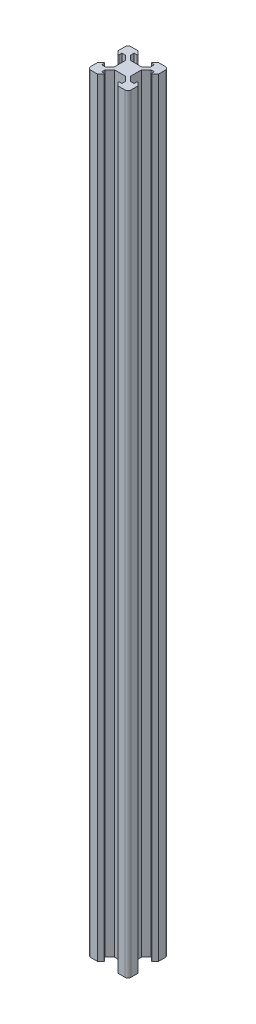
from build123d import *

# Parameters (mm, degrees)
EXTRUDE_1_DEPTH = 380


with BuildPart() as part:
    # Эскиз1 → Бобышка-Вытянуть1 (new body)
    with BuildSketch(Plane(origin=(0, 0, 0), x_dir=(1, 0, 0), z_dir=(0, 1, 0))):
        with BuildLine():
            Line((6.272792206, 5), (8, 5))
            Line((8, 5), (8, 3.724264069))
            ThreePointArc((8, 3.724264069), (8.18519497, 3.447100209), (8.512132034, 3.512132034))
            Line((8.512132034, 3.512132034), (10, 5))
            Line((10, 5), (10, 8.5))
            ThreePointArc((10, 8.5), (9.560660172, 9.560660172), (8.5, 10))
            Line((8.5, 10), (5, 10))
            Line((5, 10), (3.512132034, 8.512132034))
            ThreePointArc((3.512132034, 8.512132034), (3.447100209, 8.18519497), (3.724264069, 8))
            Line((3.724264069, 8), (5, 8))
            Line((5, 8), (5, 6.272792206))
            Line((5, 6.272792206), (2.727207794, 4))
            Line((2.727207794, 4), (-2.727207794, 4))
            Line((-2.727207794, 4), (-5, 6.272792206))
            Line((-5, 6.272792206), (-5, 8))
            Line((-5, 8), (-3.724264069, 8))
            ThreePointArc((-3.724264069, 8), (-3.447100209, 8.18519497), (-3.512132034, 8.512132034))
            Line((-3.512132034, 8.512132034), (-5, 10))
            Line((-5, 10), (-8.5, 10))
            ThreePointArc((-8.5, 10), (-9.560660172, 9.560660172), (-10, 8.5))
            Line((-10, 8.5), (-10, 5))
            Line((-10, 5), (-8.512132034, 3.512132034))
            ThreePointArc((-8.512132034, 3.512132034), (-8.18519497, 3.447100209), (-8, 3.724264069))
            Line((-8, 3.724264069), (-8, 5))
            Line((-8, 5), (-6.272792206, 5))
            Line((-6.272792206, 5), (-4, 2.727207794))
            Line((-4, 2.727207794), (-4, -2.727207794))
            Line((-4, -2.727207794), (-6.272792206, -5))
            Line((-6.272792206, -5), (-8, -5))
            Line((-8, -5), (-8, -3.724264069))
            ThreePointArc((-8, -3.724264069), (-8.18519497, -3.447100209), (-8.512132034, -3.512132034))
            Line((-8.512132034, -3.512132034), (-10, -5))
            Line((-10, -5), (-10, -8.5))
            ThreePointArc((-10, -8.5), (-9.560660172, -9.560660172), (-8.5, -10))
            Line((-8.5, -10), (-5, -10))
            Line((-5, -10), (-3.512132034, -8.512132034))
            ThreePointArc((-3.512132034, -8.512132034), (-3.447100209, -8.18519497), (-3.724264069, -8))
            Line((-3.724264069, -8), (-5, -8))
            Line((-5, -8), (-5, -6.272792206))
            Line((-5, -6.272792206), (-2.727207794, -4))
            Line((-2.727207794, -4), (2.727207794, -4))
            Line((2.727207794, -4), (5, -6.272792206))
            Line((5, -6.272792206), (5, -8))
            Line((5, -8), (3.724264069, -8))
            ThreePointArc((3.724264069, -8), (3.447100209, -8.18519497), (3.512132034, -8.512132034))
            Line((3.512132034, -8.512132034), (5, -10))
            Line((5, -10), (8.5, -10))
            ThreePointArc((8.5, -10), (9.560660172, -9.560660172), (10, -8.5))
            Line((10, -8.5), (10, -5))
            Line((10, -5), (8.512132034, -3.512132034))
            ThreePointArc((8.512132034, -3.512132034), (8.18519497, -3.447100209), (8, -3.724264069))
            Line((8, -3.724264069), (8, -5))
            Line((8, -5), (6.272792206, -5))
            Line((6.272792206, -5), (4, -2.727207794))
            Line((4, -2.727207794), (4, 2.727207794))
            Line((4, 2.727207794), (6.272792206, 5))
        make_face()
    extrude(amount=EXTRUDE_1_DEPTH)


solid = part.part
